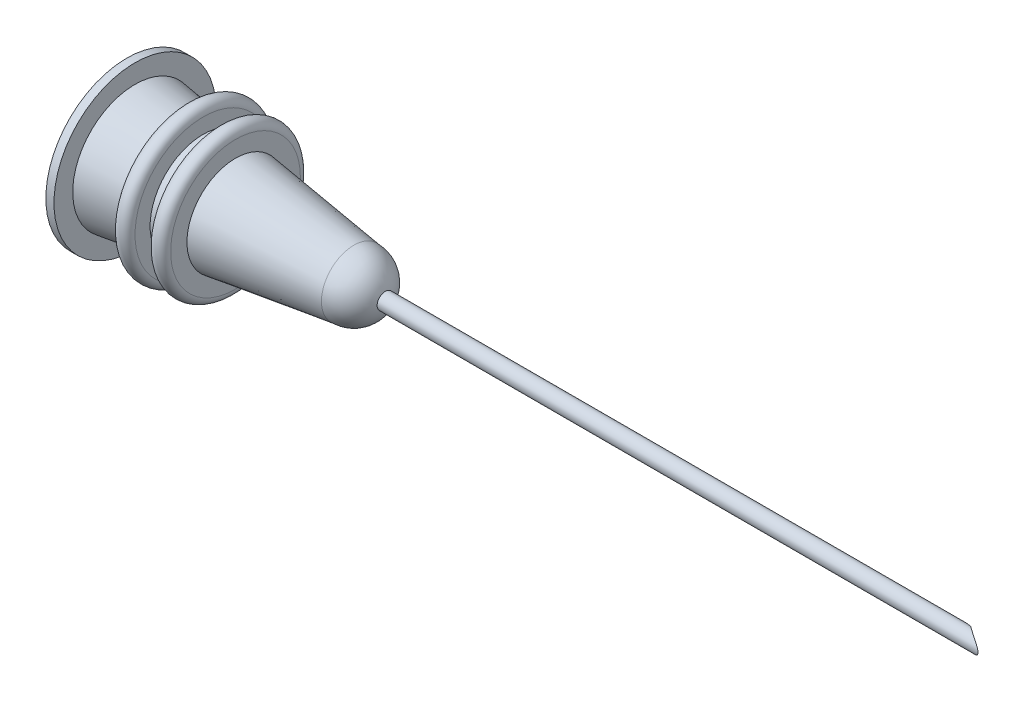
from build123d import *

# Parameters (mm, degrees)
DOME1_FACE_RADIUS       = 2
DOME1_HEIGHT            = 2
SKETCH2_R               = 0.5
CUT_EXTRUDE1_DEPTH      = 15.798648587
SKETCH3_R               = 0.5
SKETCH3_R_2             = 0.375
EXTRUDE_THIN1_DEPTH     = 40
CUT_EXTRUDE2_DEPTH      = 40.635842365
CUT_EXTRUDE2_DEPTH_BACK = 40.635842365
SKETCH4_R               = 3.5
CUT_EXTRUDE4_DEPTH      = 40.635842464
CUT_EXTRUDE4_DEPTH_BACK = 40.635842464
SKETCH5_R               = 5


with BuildPart() as part:
    # Sketch1 → Revolve1 (revolve)
    with BuildSketch(Plane.XY, mode=Mode.PRIVATE) as revolve1_sk:
        with BuildLine():
            Line((0, 0), (0, 2))
            Line((0, 2), (-7.3, 2.99628656))
            Line((-7.3, 2.99628656), (-7.3, 4))
            ThreePointArc((-7.3, 4), (-7.8, 4.5), (-8.3, 4))
            Line((-8.3, 4), (-8.3, 3.132764171))
            Line((-8.3, 3.132764171), (-9.3, 3.269241782))
            Line((-9.3, 3.269241782), (-9.3, 4.2))
            ThreePointArc((-9.3, 4.2), (-9.8, 4.7), (-10.3, 4.2))
            Line((-10.3, 4.2), (-10.3, 3.405719393))
            Line((-10.3, 3.405719393), (-13.5, 3.842447748))
            Line((-13.5, 3.842447748), (-13.5, 5))
            Line((-13.5, 5), (-14, 5))
            Line((-14, 5), (-14, 3.153733977))
            Line((-14, 3.153733977), (-1, 1.379525035))
            Line((-1, 1.379525035), (-1, 0))
            Line((-1, 0), (0, 0))
        make_face()
    revolve(revolve1_sk.sketch.rotate(Axis((0, 0, 0), (-1, 0, 0)), 90), axis=Axis((0, 0, 0), (-1, 0, 0)))

    # Dome1: a dome of height H over a round flat face of radius A is a cap of a sphere of radius (A * A + H * H) / (2 * H)
    dome1_r = (DOME1_FACE_RADIUS * DOME1_FACE_RADIUS + DOME1_HEIGHT * DOME1_HEIGHT) / (2 * DOME1_HEIGHT)
    dome1_base = Plane((0, 0, 0), z_dir=(1, 0, 0))
    with Locations(dome1_base.offset(DOME1_HEIGHT - dome1_r)):
        dome1_ball = Sphere(dome1_r, mode=Mode.PRIVATE)
    add(split(dome1_ball, bisect_by=dome1_base, keep=Keep.TOP, mode=Mode.PRIVATE))

    # Sketch2 → Cut-Extrude1 (cut, through all)
    with BuildSketch(Plane.ZY.offset(1)):
        Circle(SKETCH2_R)
    extrude(amount=-CUT_EXTRUDE1_DEPTH, mode=Mode.SUBTRACT)

    # Sketch3 → Extrude-Thin1 (add)
    with BuildSketch(Plane.ZY.offset(1)):
        Circle(SKETCH3_R)
        Circle(SKETCH3_R_2, mode=Mode.SUBTRACT)
    extrude(amount=-EXTRUDE_THIN1_DEPTH)

    # Sketch4 → Cut-Extrude2 (cut, two sides: drawn at the far end of the back side and taken through both)
    with BuildSketch(Plane(origin=(0, 0, 0), x_dir=(1, 0, 0), z_dir=(0, 1, 0)).offset(-CUT_EXTRUDE2_DEPTH_BACK)):
        with Locations((39, 3.5)):
            Circle(SKETCH4_R)
    extrude(amount=CUT_EXTRUDE2_DEPTH + CUT_EXTRUDE2_DEPTH_BACK, mode=Mode.SUBTRACT)

    # Sketch5 → Cut-Extrude4 (cut, two sides: drawn at the far end of the back side and taken through both)
    with BuildSketch(Plane(origin=(0, 0, 0), x_dir=(1, 0, 0), z_dir=(0, 1, 0)).offset(-CUT_EXTRUDE4_DEPTH_BACK)):
        with Locations((41, 4.082575695)):
            Circle(SKETCH5_R)
    extrude(amount=CUT_EXTRUDE4_DEPTH + CUT_EXTRUDE4_DEPTH_BACK, mode=Mode.SUBTRACT)


solid = part.part
